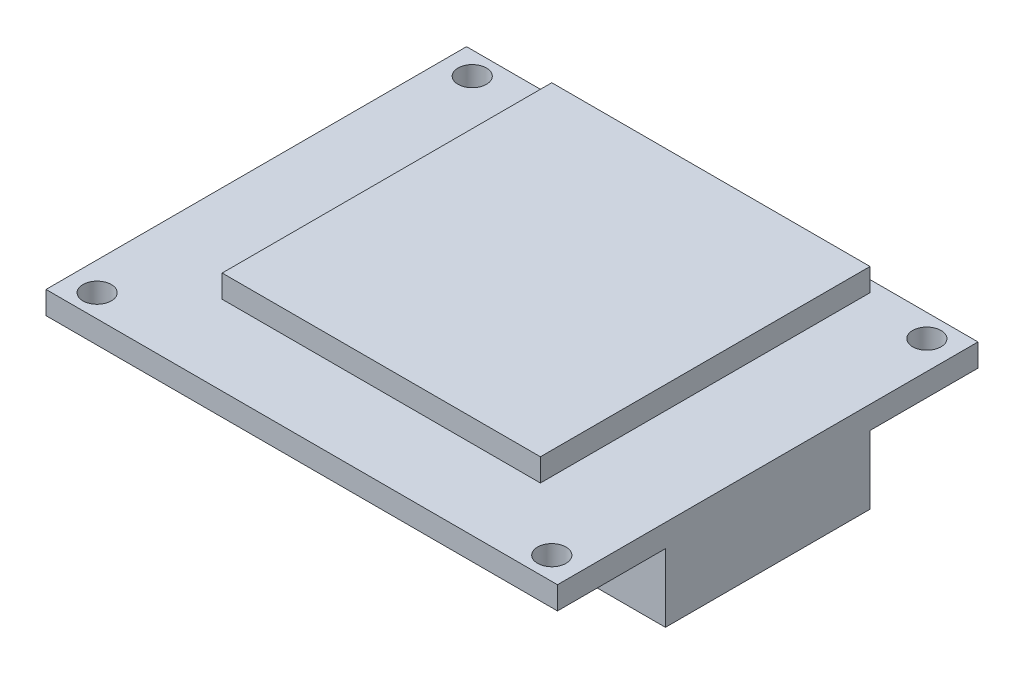
from build123d import *

# Parameters (mm, degrees)
SKETCH_1_W          = 45
SKETCH_1_H          = 37
EXTRUDE_1_DEPTH     = 2
SKETCH_2_W          = 28
SKETCH_2_H          = 29
EXTRUDE_2_DEPTH     = 2
SKETCH_3_R          = 1.25
CUT_EXTRUDE_1_DEPTH = 2
SKETCH_4_W          = 8
SKETCH_4_H          = 18
EXTRUDE_3_DEPTH     = 6


with BuildPart() as part:
    # 草图1 → 凸台-拉伸1 (new body)
    with BuildSketch(Plane(origin=(0, 0, 0), x_dir=(1, 0, 0), z_dir=(0, 1, 0))):
        with Locations((22.5, 18.5)):
            Rectangle(SKETCH_1_W, SKETCH_1_H)
    extrude(amount=EXTRUDE_1_DEPTH)

    # 草图2 → 凸台-拉伸2 (add)
    with BuildSketch(Plane(origin=(0, 2, 0), x_dir=(1, 0, 0), z_dir=(0, 1, 0))):
        with Locations((22.5, 21.5)):
            Rectangle(SKETCH_2_W, SKETCH_2_H)
    extrude(amount=EXTRUDE_2_DEPTH)

    # 草图3 → 切除-拉伸1 (cut)
    with BuildSketch(Plane(origin=(0, 2, 0), x_dir=(1, 0, 0), z_dir=(0, 1, 0))):
        with Locations(Location((2.5, 35, 0), (0, 0, 270))):
            Circle(SKETCH_3_R)
        with Locations(Location((42.5, 35, 0), (0, 0, 90))):
            Circle(SKETCH_3_R)
        with Locations(Location((42.5, 2, 0), (0, 0, 270))):
            Circle(SKETCH_3_R)
        with Locations(Location((2.5, 2, 0), (0, 0, 90))):
            Circle(SKETCH_3_R)
    extrude(amount=-CUT_EXTRUDE_1_DEPTH, mode=Mode.SUBTRACT)

    # 草图4 → 凸台-拉伸3 (add)
    with BuildSketch(Plane.XZ):
        with Locations((41, -18.5)):
            Rectangle(SKETCH_4_W, SKETCH_4_H)
    extrude(amount=EXTRUDE_3_DEPTH)


solid = part.part
